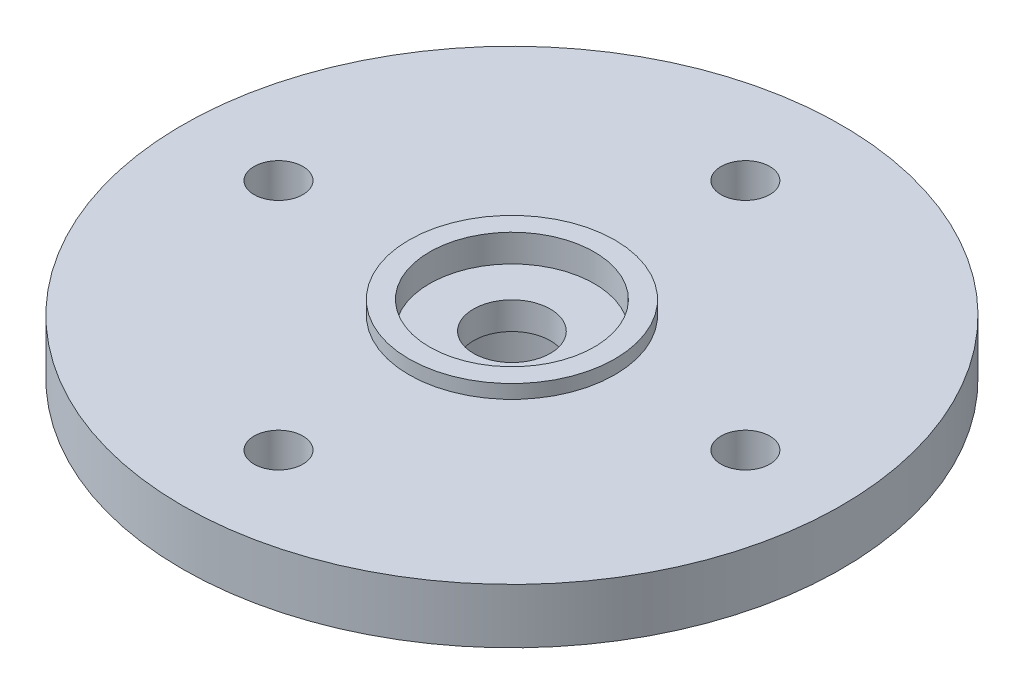
from build123d import *

# Parameters (mm, degrees)
F_2_56_TAPPED_HOLE1_D = 1.778
SKETCH4_R             = 3
CUT_EXTRUDE1_DEPTH    = 1
CUT_EXTRUDE2_START    = -3
SKETCH5_R             = 3
CUT_EXTRUDE2_DEPTH    = 3


with BuildPart() as part:
    # Sketch1 → Revolve1 (revolve)
    with BuildSketch(Plane.XY, mode=Mode.PRIVATE) as revolve1_sk:
        Polygon((-12, 0), (-3.75, 0), (-3.75, 0.5), (-1.4, 0.5), (-1.4, -4.5), (-4.5, -4.5), (-4.5, -2), (-12, -2), align=None)
    revolve(revolve1_sk.sketch.rotate(Axis((0, 0, 0), (0, -1, 0)), 270), axis=Axis((0, 0, 0), (0, -1, 0)))

    # #2-56 Tapped Hole1 (through all)
    with Locations(Plane(origin=(0, 0, 0), x_dir=(-1, 0, 0), z_dir=(0, 1, 0))):
        with Locations((0, -8.5), (8.5, 0), (-8.5, 0), (0, 8.5)):
            Hole(F_2_56_TAPPED_HOLE1_D / 2)

    # Sketch4 → Cut-Extrude1 (cut)
    with BuildSketch(Plane(origin=(0, 0.5, 0), x_dir=(-1, 0, 0), z_dir=(0, 1, 0))):
        with Locations(Location((0, 0, 0), (0, 0, 90))):
            Circle(SKETCH4_R)
    extrude(amount=-CUT_EXTRUDE1_DEPTH, mode=Mode.SUBTRACT)

    # Sketch5 → Cut-Extrude2 (cut)
    with BuildSketch(Plane.XZ.offset(4.5).offset(CUT_EXTRUDE2_START)):
        with Locations(Location((0, 0, 0), (0, 0, 90))):
            Circle(SKETCH5_R)
    extrude(amount=CUT_EXTRUDE2_DEPTH, mode=Mode.SUBTRACT)


solid = part.part
